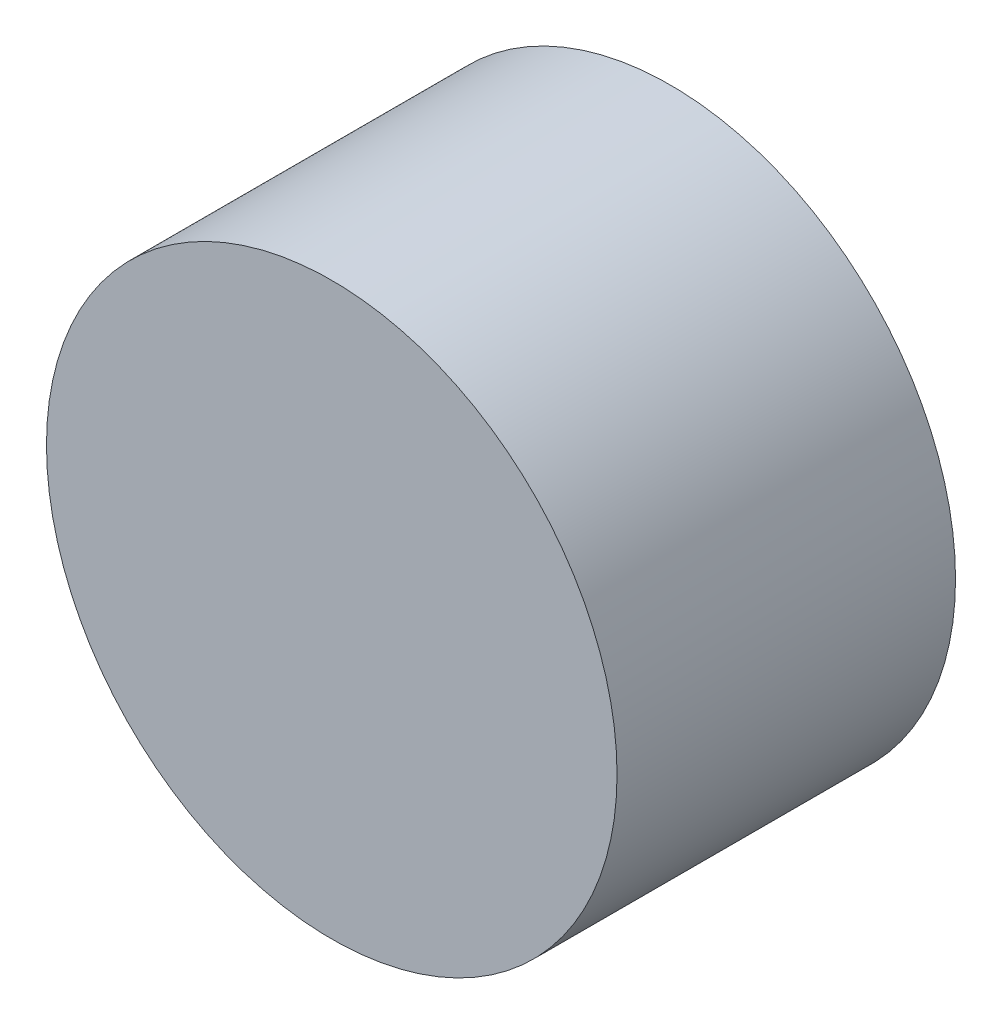
from build123d import *

# Parameters (mm, degrees)
SKETCH1_R           = 2.95
BOSS_EXTRUDE1_DEPTH = 3.5


with BuildPart() as part:
    # Sketch1 → Boss-Extrude1 (new body)
    with BuildSketch(Plane.XY):
        Circle(SKETCH1_R)
    extrude(amount=BOSS_EXTRUDE1_DEPTH)


solid = part.part
